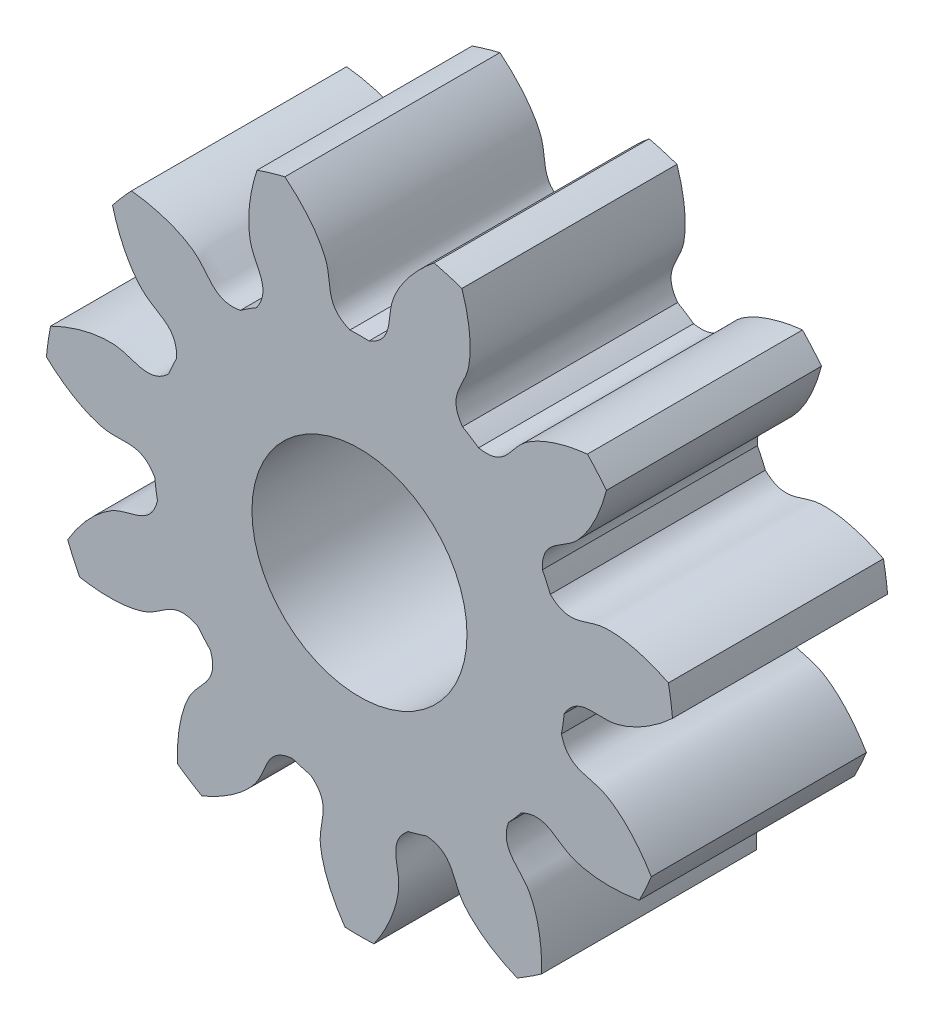
from build123d import *

# Parameters (mm, degrees)
SKETCH_1_R               = 2.925
EXTRUDE_1_DEPTH          = 2
CUT_EXTRUDE_1_DEPTH      = 5.594698031
PATTERN_CIRCULAR_1_COUNT = 11
SKETCH_4_R               = 1
CUT_EXTRUDE_2_DEPTH      = 5.586010584


with BuildPart() as part:
    # 草图1 → 凸台-拉伸1 (new body)
    with BuildSketch(Plane.XY):
        Circle(SKETCH_1_R)
    extrude(amount=EXTRUDE_1_DEPTH)

    # 草图2 → 切除-拉伸1 (cut, through all)
    with BuildSketch(Plane.XY):
        with BuildLine():
            ThreePointArc((0.08852987, 1.910449872), (0, 1.9125), (-0.08852987, 1.910449872))
            add(Edge.make_bspline(
                [(-0.08852987, 1.910449872), (-0.315659965, 2.000967152), (-0.258573558, 2.186101094), (-0.30708141, 2.343391426), (-0.309851997, 2.351784125), (-0.313099285, 2.36099721), (-0.316856321, 2.371014779), (-0.321156684, 2.381819732), (-0.326033159, 2.393394013), (-0.331518116, 2.405718553), (-0.337643355, 2.418773307), (-0.344440121, 2.432537255), (-0.351939064, 2.446988429), (-0.360170218, 2.462103917), (-0.369162977, 2.477859886), (-0.378946065, 2.494231597), (-0.389547516, 2.511193422), (-0.40099465, 2.52871886), (-0.413314046, 2.546780561), (-0.426531524, 2.565350339), (-0.440672115, 2.584399192), (-0.455760047, 2.60389733), (-0.471818719, 2.623814185), (-0.488870679, 2.644118439), (-0.506937607, 2.664778045), (-0.526040291, 2.685760249), (-0.54619861, 2.707031611), (-0.567431515, 2.728558032), (-0.589757009, 2.750304773), (-0.613192131, 2.772236485), (-0.637752937, 2.794317231), (-0.663454485, 2.816510508), (-0.690310819, 2.838779279), (-0.718334952, 2.861085995), (-0.747538853, 2.883392624), (-0.777933432, 2.905660673), (-0.809528526, 2.927851221), (-0.842332889, 2.949924944), (-0.876354178, 2.971842142), (-0.911598939, 2.99356277), (-0.948072603, 3.015046462), (-0.985779468, 3.036252566), (-1.024722698, 3.057140166), (-1.064904306, 3.077668119), (-1.106325154, 3.097795078), (-1.14898494, 3.117479524), (-1.192882194, 3.136679798), (-1.238014275, 3.155354129), (-1.284377358, 3.173460665), (-1.331966441, 3.190957502), (-1.380775332, 3.207802719), (-1.430796652, 3.223954403), (-1.482021826, 3.239370684), (-1.552511573, 3.259056282), (-1.606261107, 3.272328319), (-1.642556163, 3.280536787)],
                knots=[0, 0, 0, 0, 0.219011067, 0.222641587, 0.226699227, 0.231183987, 0.236095867, 0.241434867, 0.247200988, 0.253394228, 0.260014588, 0.267062068, 0.274536668, 0.282438388, 0.290767228, 0.299523189, 0.308706269, 0.318316469, 0.328353789, 0.338818229, 0.34970979, 0.36102847, 0.37277427, 0.38494719, 0.39754723, 0.410574391, 0.424028671, 0.437910071, 0.452218591, 0.466954232, 0.482116992, 0.497706872, 0.513723872, 0.530167993, 0.547039233, 0.564337593, 0.582063073, 0.600215674, 0.618795394, 0.637802234, 0.657236195, 0.677097275, 0.697385475, 0.718100796, 0.739243236, 0.760812796, 0.782809477, 0.805233277, 0.828084197, 0.851362238, 0.875067398, 0.899199678, 0.923759079, 0.948745599, 1, 1, 1, 1], degree=3))
            ThreePointArc((-1.642556163, 3.280536787), (0, 3.668775321), (1.642556163, 3.280536787))
            add(Edge.make_bspline(
                [(0.08852987, 1.910449872), (0.315659965, 2.000967152), (0.258573558, 2.186101094), (0.30708141, 2.343391426), (0.309851997, 2.351784125), (0.313099285, 2.36099721), (0.316856321, 2.371014779), (0.321156684, 2.381819732), (0.326033159, 2.393394013), (0.331518116, 2.405718553), (0.337643355, 2.418773307), (0.344440121, 2.432537255), (0.351939064, 2.446988429), (0.360170218, 2.462103917), (0.369162977, 2.477859886), (0.378946065, 2.494231597), (0.389547516, 2.511193422), (0.40099465, 2.52871886), (0.413314046, 2.546780561), (0.426531524, 2.565350339), (0.440672115, 2.584399192), (0.455760047, 2.60389733), (0.471818719, 2.623814185), (0.488870679, 2.644118439), (0.506937607, 2.664778045), (0.526040291, 2.685760249), (0.54619861, 2.707031611), (0.567431515, 2.728558032), (0.589757009, 2.750304773), (0.613192131, 2.772236485), (0.637752937, 2.794317231), (0.663454485, 2.816510508), (0.690310819, 2.838779279), (0.718334952, 2.861085995), (0.747538853, 2.883392624), (0.777933432, 2.905660673), (0.809528526, 2.927851221), (0.842332889, 2.949924944), (0.876354178, 2.971842142), (0.911598939, 2.99356277), (0.948072603, 3.015046462), (0.985779468, 3.036252566), (1.024722698, 3.057140166), (1.064904306, 3.077668119), (1.106325154, 3.097795078), (1.14898494, 3.117479524), (1.192882194, 3.136679798), (1.238014275, 3.155354129), (1.284377358, 3.173460665), (1.331966441, 3.190957502), (1.380775332, 3.207802719), (1.430796652, 3.223954403), (1.482021826, 3.239370684), (1.552511573, 3.259056282), (1.606261107, 3.272328319), (1.642556163, 3.280536787)],
                knots=[0, 0, 0, 0, 0.219011067, 0.222641587, 0.226699227, 0.231183987, 0.236095867, 0.241434867, 0.247200988, 0.253394228, 0.260014588, 0.267062068, 0.274536668, 0.282438388, 0.290767228, 0.299523189, 0.308706269, 0.318316469, 0.328353789, 0.338818229, 0.34970979, 0.36102847, 0.37277427, 0.38494719, 0.39754723, 0.410574391, 0.424028671, 0.437910071, 0.452218591, 0.466954232, 0.482116992, 0.497706872, 0.513723872, 0.530167993, 0.547039233, 0.564337593, 0.582063073, 0.600215674, 0.618795394, 0.637802234, 0.657236195, 0.677097275, 0.697385475, 0.718100796, 0.739243236, 0.760812796, 0.782809477, 0.805233277, 0.828084197, 0.851362238, 0.875067398, 0.899199678, 0.923759079, 0.948745599, 1, 1, 1, 1], degree=3))
        make_face()
    cut_extrude_1 = extrude(amount=CUT_EXTRUDE_1_DEPTH, mode=Mode.SUBTRACT)

    # 阵列(圆周)1: 切除-拉伸1 ×11 about axis
    pattern_circular_1_axis = Axis((0, 0, 2), (0, 0, -1))
    for i in range(1, PATTERN_CIRCULAR_1_COUNT):
        add(cut_extrude_1.rotate(pattern_circular_1_axis, i * 360 / PATTERN_CIRCULAR_1_COUNT), mode=Mode.SUBTRACT)

    # 草图4 → 切除-拉伸2 (cut, through all)
    with BuildSketch(Plane.XY.offset(2)):
        Circle(SKETCH_4_R)
    extrude(amount=-CUT_EXTRUDE_2_DEPTH, mode=Mode.SUBTRACT)


solid = part.part
